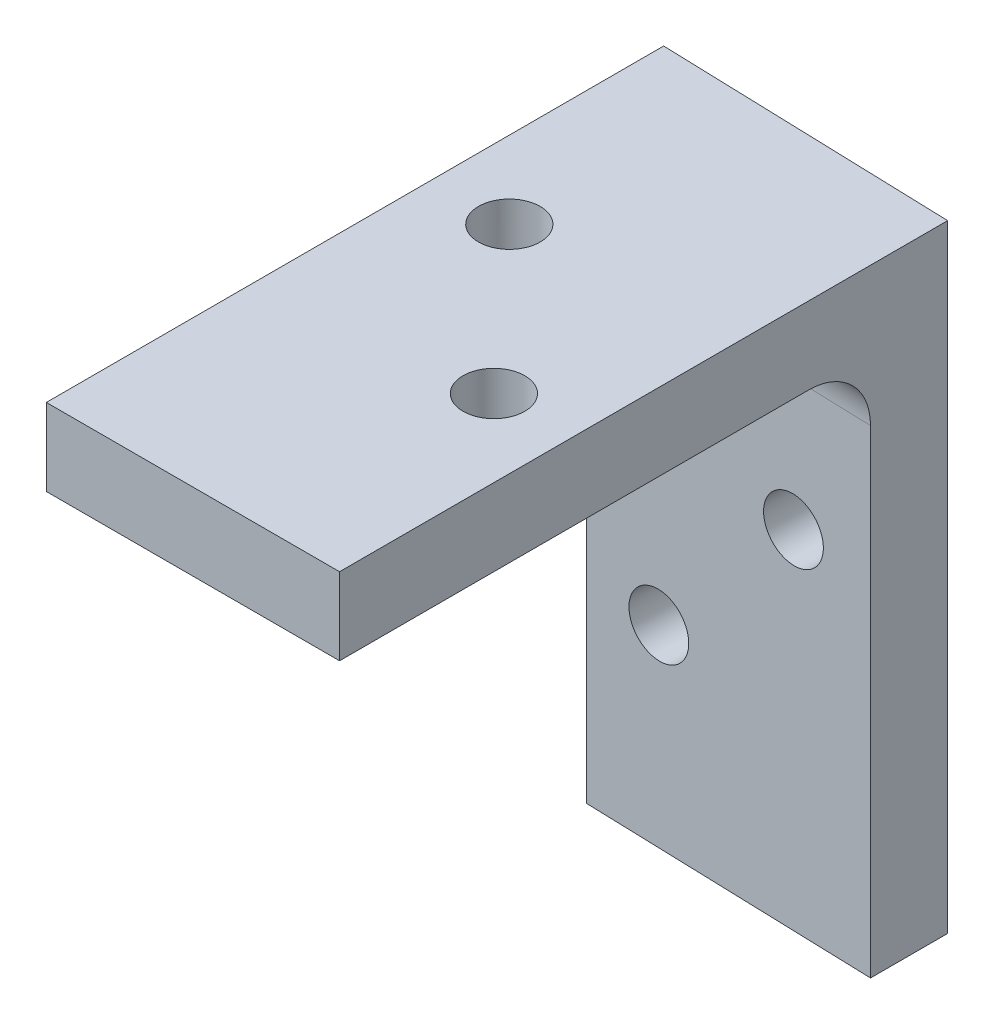
from build123d import *

# Parameters (mm, degrees)
SKETCH1_W           = 19
SKETCH1_H           = 40
BOSS_EXTRUDE1_DEPTH = 5
CUT_EXTRUDE1_DEPTH  = 23.699118926
BOSS_EXTRUDE2_DEPTH = 35
SKETCH5_R           = 2
CUT_EXTRUDE2_DEPTH  = 46.719251962
SKETCH6_R           = 2
CUT_EXTRUDE3_DEPTH  = 54.870648729
FILLET1_R           = 4


with BuildPart() as part:
    # Sketch1 → Boss-Extrude1 (new body)
    with BuildSketch(Plane(origin=(0, 0, 0), x_dir=(1, 0, 0), z_dir=(0, 1, 0))):
        Rectangle(SKETCH1_W, SKETCH1_H)
    extrude(amount=BOSS_EXTRUDE1_DEPTH)

    # Sketch2 → Cut-Extrude1 (cut, through all)
    with BuildSketch(Plane(origin=(0, 5, 0), x_dir=(1, 0, 0), z_dir=(0, 1, 0))):
        Polygon((-9.5, 20), (9.5, 20), (9.5, 19.402900945), align=None)
    extrude(amount=-CUT_EXTRUDE1_DEPTH, mode=Mode.SUBTRACT)

    # Sketch4 → Boss-Extrude2 (add)
    with BuildSketch(Plane.XZ):
        Polygon((9.5, -19.402900945), (-9.5, -20), (-9.5, -15), (9.5, -14.402900945), align=None)
    extrude(amount=BOSS_EXTRUDE2_DEPTH)

    # Sketch5 → Cut-Extrude2 (cut, through all)
    with BuildSketch(Plane(origin=(0, 5, 0), x_dir=(1, 0, 0), z_dir=(0, 1, 0))):
        with Locations(Location((-4.5, 5, 0), (0, 0, 270))):
            Circle(SKETCH5_R)
        with Locations(Location((4.5, -5, 0), (0, 0, 270))):
            Circle(SKETCH5_R)
    extrude(amount=-CUT_EXTRUDE2_DEPTH, mode=Mode.SUBTRACT)

    # Sketch6 → Cut-Extrude3 (cut, through all)
    with BuildSketch(Plane(origin=(0.618532155, 0, -19.682012317), x_dir=(-0.9995065603657318, 0, -0.03141075907812129), z_dir=(0.03141075907812129, 0, -0.9995065603657318))):
        with Locations((-3.885852476, -12.5)):
            Circle(SKETCH6_R)
        with Locations((5.123527505, -22.5)):
            Circle(SKETCH6_R)
    extrude(amount=-CUT_EXTRUDE3_DEPTH, mode=Mode.SUBTRACT)

    # Fillet1
    fillet1_edges = [part.edges().sort_by_distance(p)[0] for p in [
        (0, 0, -14.701450473),
    ]]
    fillet(fillet1_edges, radius=FILLET1_R)


solid = part.part
